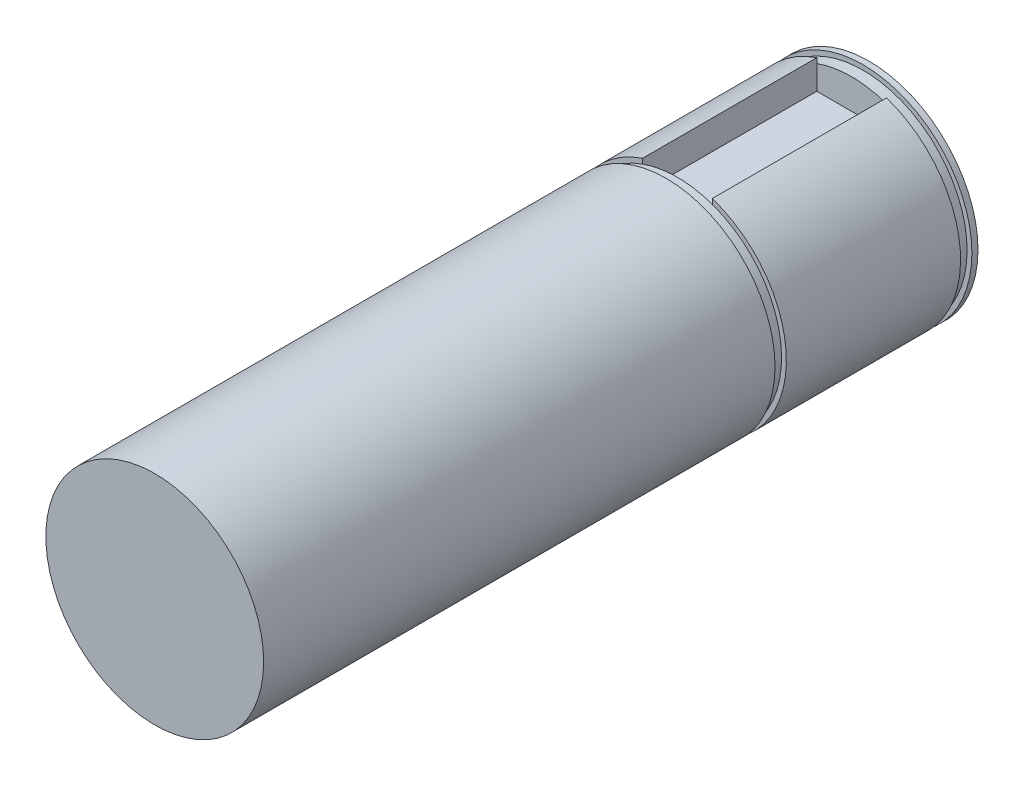
from build123d import *

# Parameters (mm, degrees)
BOSS_EXTRUDE1_DEPTH      = 80
BOSS_EXTRUDE1_DEPTH_BACK = 2
SKETCH1_R                = 12.5
CUT_EXTRUDE1_START       = -2
CUT_EXTRUDE1_DEPTH       = 20
SKETCH4_W                = 1.3
SKETCH4_H                = 0.55
SKETCH5_W                = 1.3
SKETCH5_H                = 0.55


with BuildPart() as part:
    # Sketch1 → Boss-Extrude1 (new, two sides: drawn at the far end of the back side and taken through both)
    with BuildSketch(Plane.XY.offset(-BOSS_EXTRUDE1_DEPTH_BACK)):
        Circle(SKETCH1_R)
    extrude(amount=BOSS_EXTRUDE1_DEPTH + BOSS_EXTRUDE1_DEPTH_BACK)

    # Sketch2 → Cut-Extrude1 (cut)
    with BuildSketch(Plane(origin=(0, 0, -2), x_dir=(-1, 0, 0), z_dir=(0, 0, -1)).offset(CUT_EXTRUDE1_START)):
        with BuildLine():
            Line((-4, 11.842719282), (-4, 8.5))
            Line((-4, 8.5), (4, 8.5))
            Line((4, 8.5), (4, 11.842719282))
            ThreePointArc((4, 11.842719282), (0, 12.5), (-4, 11.842719282))
        make_face()
    extrude(amount=-CUT_EXTRUDE1_DEPTH, mode=Mode.SUBTRACT)

    # Sketch4 → Cut-Revolve1 (revolve, cut)
    with BuildSketch(Plane(origin=(0, 0, 0), x_dir=(0, 0, -1), z_dir=(1, 0, 0)), mode=Mode.PRIVATE) as cut_revolve1_sk:
        with Locations((0.65, 12.225)):
            Rectangle(SKETCH4_W, SKETCH4_H)
    revolve(cut_revolve1_sk.sketch.rotate(Axis((0, 0, -5.566261423), (0, 0, 1)), 270), axis=Axis((0, 0, -5.566261423), (0, 0, 1)), mode=Mode.SUBTRACT)

    # Sketch5 → Cut-Revolve2 (revolve, cut)
    with BuildSketch(Plane(origin=(0, 0, 0), x_dir=(0, 0, -1), z_dir=(1, 0, 0)), mode=Mode.PRIVATE) as cut_revolve2_sk:
        with Locations((-20.65, 12.225)):
            Rectangle(SKETCH5_W, SKETCH5_H)
    revolve(cut_revolve2_sk.sketch.rotate(Axis((0, 0, 0), (0, 0, 1)), 90), axis=Axis((0, 0, 0), (0, 0, 1)), mode=Mode.SUBTRACT)


solid = part.part
